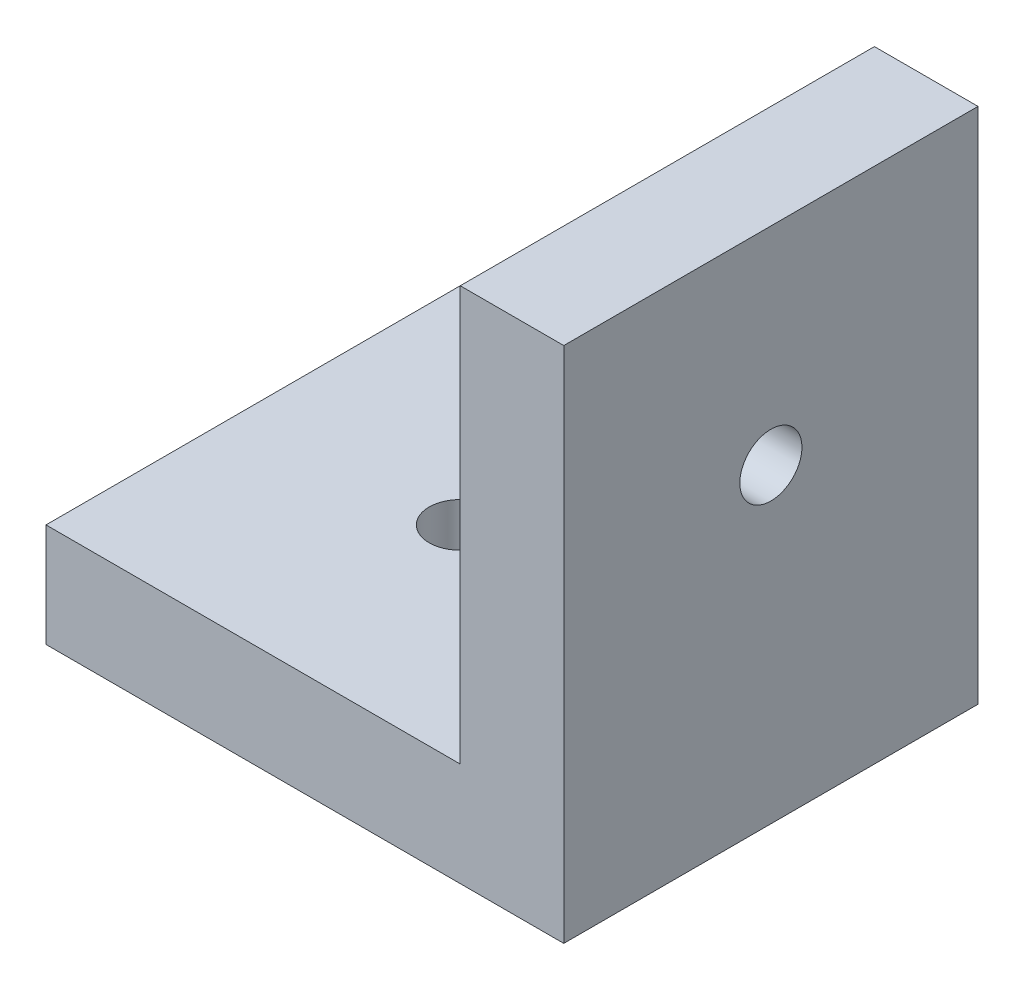
from build123d import *

# Parameters (mm, degrees)
SKETCH_1_W          = 5
SKETCH_1_H          = 20
SKETCH_1_H_2        = 5
SKETCH_1_W_2        = 20
EXTRUDE_1_DEPTH     = 20
CUT_EXTRUDE_1_REACH = 36.641
SKETCH_2_R          = 1.5
CUT_EXTRUDE_2_REACH = 39.749
SKETCH_3_R          = 1.5


with BuildPart() as part:
    # 草图1 → 凸台-拉伸1 (new body)
    with BuildSketch(Plane.XY):
        with Locations((2.5, -10)):
            Rectangle(SKETCH_1_W, SKETCH_1_H)
        with Locations((2.5, -22.5)):
            Rectangle(SKETCH_1_W, SKETCH_1_H_2)
        with Locations((-10, -22.5)):
            Rectangle(SKETCH_1_W_2, SKETCH_1_H_2)
    extrude(amount=EXTRUDE_1_DEPTH)

    # 草图2 → 切除-拉伸1 (cut, up to next)
    with BuildSketch(Plane(origin=(0, -20, 0), x_dir=(1, 0, 0), z_dir=(0, 1, 0)), mode=Mode.PRIVATE) as cut_extrude_1_sk1:
        with Locations(Location((-10, -10, 0), (0, 0, 180))):
            Circle(SKETCH_2_R)
    cut_extrude_1_tool1 = extrude(cut_extrude_1_sk1.sketch, amount=-CUT_EXTRUDE_1_REACH, mode=Mode.PRIVATE) & part.part
    add(cut_extrude_1_tool1.solids().sort_by_distance((-10, -20, 10))[0], mode=Mode.SUBTRACT)

    # 草图3 → 切除-拉伸2 (cut, up to next)
    with BuildSketch(Plane.ZY, mode=Mode.PRIVATE) as cut_extrude_2_sk1:
        with Locations(Location((10, -10, 0), (0, 0, 270))):
            Circle(SKETCH_3_R)
    cut_extrude_2_tool1 = extrude(cut_extrude_2_sk1.sketch, amount=-CUT_EXTRUDE_2_REACH, mode=Mode.PRIVATE) & part.part
    add(cut_extrude_2_tool1.solids().sort_by_distance((0, -10, 10))[0], mode=Mode.SUBTRACT)


solid = part.part
